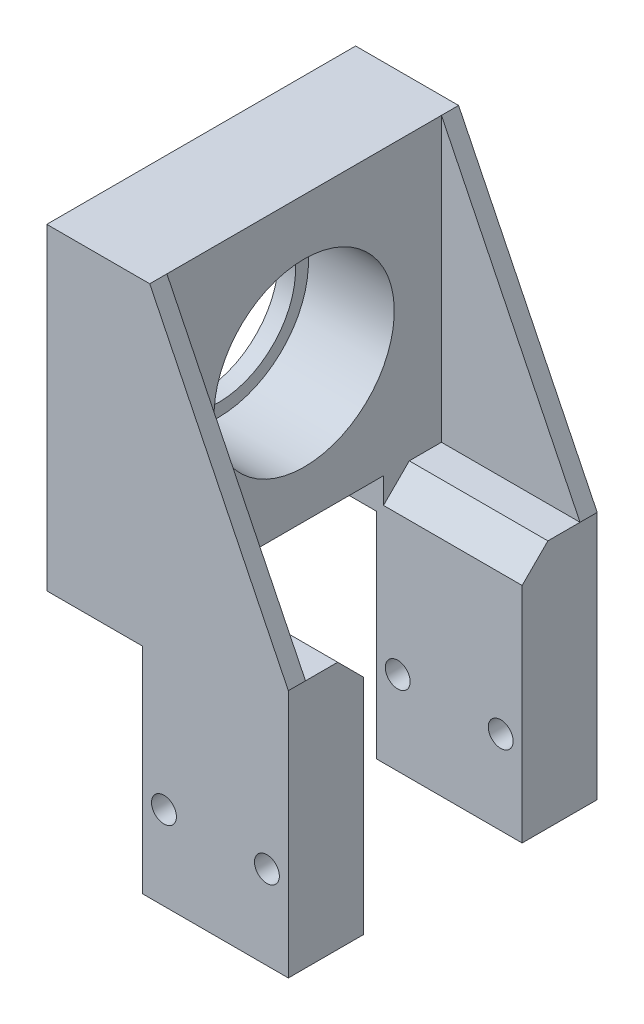
from build123d import *

# Parameters (mm, degrees)
BOSS_EXTRUDE1_DEPTH    = 36
SKETCH2_R              = 10.5
CUT_EXTRUDE1_DEPTH     = 74.491730036
SKETCH3_W              = 18.5
SKETCH3_H              = 29
CUT_EXTRUDE2_DEPTH     = 78.024618067
RIB1_REACH             = 75.682
SKETCH4_WALL_W         = 186.1063102
SKETCH4_WALL_H         = 2
RIB2_REACH             = 75.682
SKETCH5_WALL_W         = 186.1063102
SKETCH5_WALL_H         = 2
CHAMFER1_SIZE          = 3
BOSS_EXTRUDE2_START    = -2
SKETCH6_R              = 10.5
SKETCH6_R_2            = 9
BOSS_EXTRUDE2_DEPTH    = 2
M2_5_CLEARANCE_HOLE1_D = 2.9
SKETCH10_R             = 15
SKETCH10_R_2           = 11
CUT_EXTRUDE4_DEPTH     = 0.6


with BuildPart() as part:
    # Sketch1 → Boss-Extrude1 (new body)
    with BuildSketch(Plane.XY):
        Polygon((0, 0), (17, 0), (17, 29), (0.843441467, 29), (0.843441467, 62), (-11.156558533, 62), (-11.156558533, 25), (0, 25), align=None)
    extrude(amount=BOSS_EXTRUDE1_DEPTH)

    # Sketch2 → Cut-Extrude1 (cut, through all)
    with BuildSketch(Plane(origin=(0.843441467, 0, 0), x_dir=(0, 0, -1), z_dir=(1, 0, 0))):
        with Locations(Location((-18, 45, 0), (0, 0, 90))):
            Circle(SKETCH2_R)
    extrude(amount=-CUT_EXTRUDE1_DEPTH, mode=Mode.SUBTRACT)

    # Sketch3 → Cut-Extrude2 (cut, through all)
    with BuildSketch(Plane(origin=(17, 0, 0), x_dir=(0, 0, -1), z_dir=(1, 0, 0))):
        with Locations((-18, 14.5)):
            Rectangle(SKETCH3_W, SKETCH3_H)
    extrude(amount=-CUT_EXTRUDE2_DEPTH, mode=Mode.SUBTRACT)

    # Sketch4 wall → Rib1 (add, up to next)
    with BuildSketch(Plane(origin=(8.921720734, 45.5, 36), x_dir=(0.439720227065, -0.898134801636, 0), z_dir=(0.898134801636, 0.439720227065, 0)), mode=Mode.PRIVATE) as rib1_sk1:
        with Locations((0, 1)):
            Rectangle(SKETCH4_WALL_W, SKETCH4_WALL_H)
    rib1_tool1 = extrude(rib1_sk1.sketch, amount=-RIB1_REACH, mode=Mode.PRIVATE) - part.part
    add(rib1_tool1.solids().sort_by_distance((8.921720734, 45.5, 36))[0])

    # Sketch5 wall → Rib2 (add, up to next)
    with BuildSketch(Plane(origin=(8.921720734, 45.5, 0), x_dir=(0.439720227065, -0.898134801636, 0), z_dir=(-0.898134801636, -0.439720227065, 0)), mode=Mode.PRIVATE) as rib2_sk1:
        with Locations((0, 1)):
            Rectangle(SKETCH5_WALL_W, SKETCH5_WALL_H)
    rib2_tool1 = extrude(rib2_sk1.sketch, amount=RIB2_REACH, mode=Mode.PRIVATE) - part.part
    add(rib2_tool1.solids().sort_by_distance((8.921720734, 45.5, 0))[0])

    # Chamfer1
    chamfer1_edges = [part.edges().sort_by_distance(p)[0] for p in [
        (8.921720733, 29, 8.75),
        (8.921720733, 29, 27.25),
    ]]
    chamfer(chamfer1_edges, length=CHAMFER1_SIZE)

    # Sketch6 → Boss-Extrude2 (add)
    with BuildSketch(Plane.ZY.offset(11.156558533).offset(BOSS_EXTRUDE2_START)):
        with Locations(Location((18, 45, 0), (0, 0, 90))):
            Circle(SKETCH6_R)
        with Locations(Location((18, 45, 0), (0, 0, 270))):
            Circle(SKETCH6_R_2, mode=Mode.SUBTRACT)
    extrude(amount=BOSS_EXTRUDE2_DEPTH)

    # M2.5 Clearance Hole1 (through all)
    with Locations(Plane.XY.offset(36)):
        with Locations((2.5, 9.75), (14.5, 9.75)):
            Hole(M2_5_CLEARANCE_HOLE1_D / 2)

    # Sketch10 → Cut-Extrude4 (cut)
    with BuildSketch(Plane.ZY.offset(11.156558533)):
        with Locations(Location((18, 45, 0), (0, 0, 270))):
            Circle(SKETCH10_R)
        with Locations(Location((18, 45, 0), (0, 0, 270))):
            Circle(SKETCH10_R_2, mode=Mode.SUBTRACT)
    extrude(amount=-CUT_EXTRUDE4_DEPTH, mode=Mode.SUBTRACT)


solid = part.part
